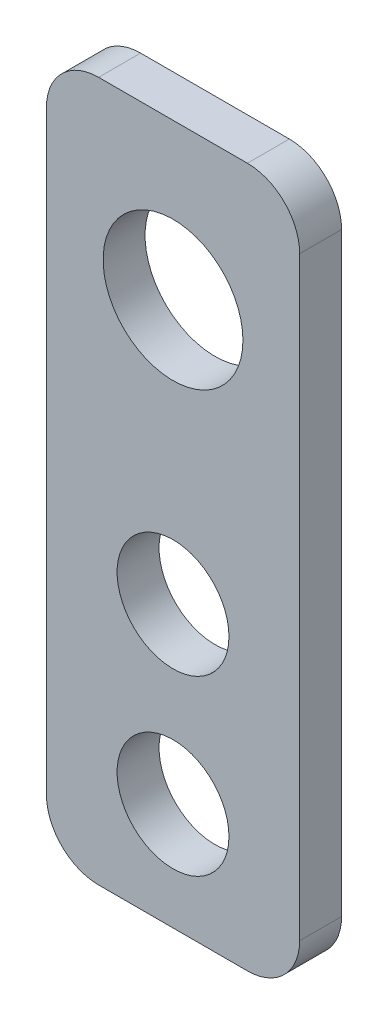
from build123d import *

# Parameters (mm, degrees)
SKETCH1_R           = 4
SKETCH1_R_2         = 5
BOSS_EXTRUDE1_DEPTH = 3


with BuildPart() as part:
    # Sketch1 → Boss-Extrude1 (new body)
    with BuildSketch(Plane.XY):
        with BuildLine():
            Line((-80.425564374, 96.680246319), (-69.786632227, 96.680246319))
            ThreePointArc((-69.786632227, 96.680246319), (-67.144628902, 97.774599928), (-66.050275293, 100.416603253))
            Line((-66.050275293, 100.416603253), (-66.050275293, 142.972331842))
            ThreePointArc((-66.050275293, 142.972331842), (-67.144628902, 145.614335167), (-69.786632227, 146.708688776))
            Line((-69.786632227, 146.708688776), (-80.425564374, 146.708688776))
            ThreePointArc((-80.425564374, 146.708688776), (-83.067567699, 145.614335167), (-84.161921308, 142.972331842))
            Line((-84.161921308, 142.972331842), (-84.161921308, 100.416603253))
            ThreePointArc((-84.161921308, 100.416603253), (-83.067567699, 97.774599928), (-80.425564374, 96.680246319))
        make_face()
        with Locations((-75.106098301, 104.343716036)):
            Circle(SKETCH1_R, mode=Mode.SUBTRACT)
        with Locations((-75.106098301, 116.730443274)):
            Circle(SKETCH1_R, mode=Mode.SUBTRACT)
        with Locations((-75.106098301, 135.57981081)):
            Circle(SKETCH1_R_2, mode=Mode.SUBTRACT)
    extrude(amount=BOSS_EXTRUDE1_DEPTH)


solid = part.part
